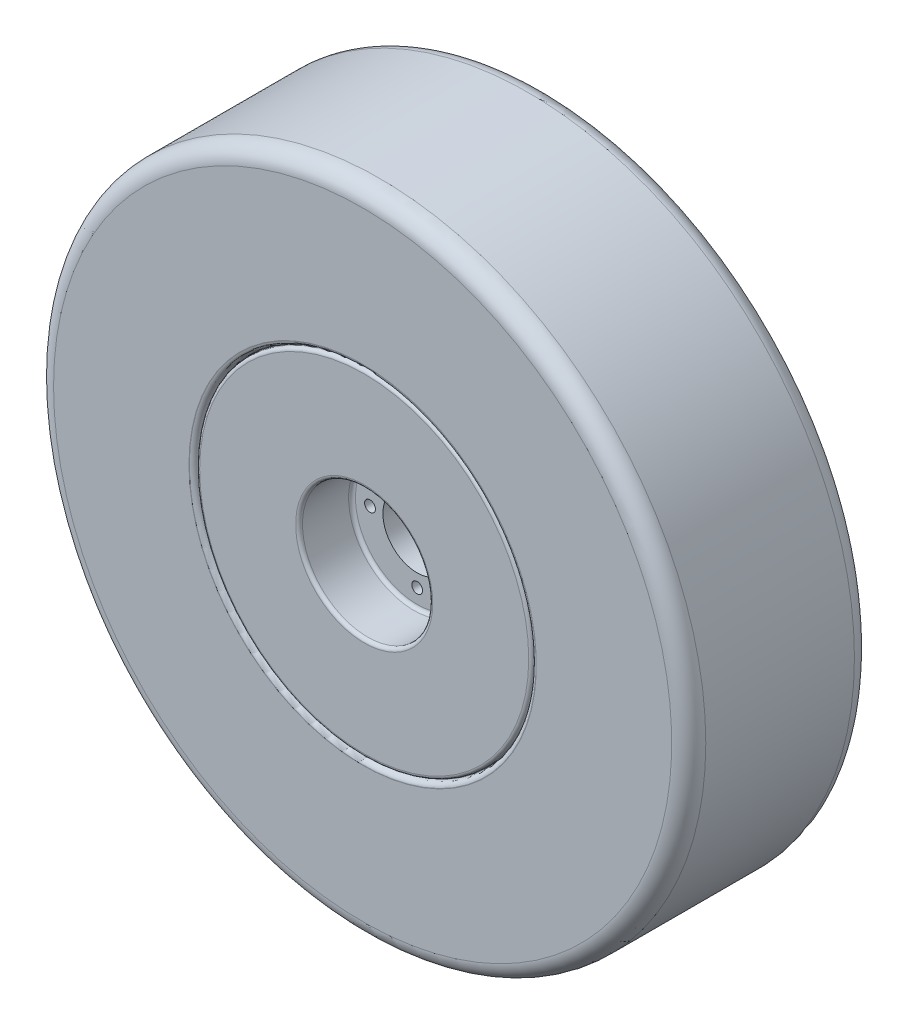
from build123d import *

# Parameters (mm, degrees)
CROQUIS2_R            = 4.0005
CORTAR_EXTRUIR1_DEPTH = 200.591359279


with BuildPart() as part:
    # Croquis1 → Revolución1 (revolve)
    with BuildSketch(Plane(origin=(0, 0, 0), x_dir=(0, 0, -1), z_dir=(1, 0, 0)), mode=Mode.PRIVATE) as revoluci_n1_sk:
        with BuildLine():
            Line((-2.032, 25.4), (52.832, 25.4))
            Line((52.832, 25.4), (52.832, 45.72))
            ThreePointArc((52.832, 45.72), (53.575948776, 47.516051224), (55.372, 48.26))
            Line((55.372, 48.26), (89.535, 48.26))
            ThreePointArc((89.535, 48.26), (91.331051224, 49.003948776), (92.075, 50.8))
            Line((92.075, 50.8), (92.075, 121.92))
            ThreePointArc((92.075, 121.92), (91.331051224, 123.716051224), (89.535, 124.46))
            Line((89.535, 124.46), (81.915, 124.46))
            ThreePointArc((81.915, 124.46), (80.118948776, 123.716051224), (79.375, 121.92))
            Line((79.375, 121.92), (79.375, 63.5))
            ThreePointArc((79.375, 63.5), (78.631051224, 61.703948776), (76.835, 60.96))
            Line((76.835, 60.96), (-26.035, 60.96))
            ThreePointArc((-26.035, 60.96), (-27.831051224, 61.703948776), (-28.575, 63.5))
            Line((-28.575, 63.5), (-28.575, 121.92))
            ThreePointArc((-28.575, 121.92), (-29.318948776, 123.716051224), (-31.115, 124.46))
            Line((-31.115, 124.46), (-38.735, 124.46))
            ThreePointArc((-38.735, 124.46), (-40.531051224, 123.716051224), (-41.275, 121.92))
            Line((-41.275, 121.92), (-41.275, 50.8))
            ThreePointArc((-41.275, 50.8), (-40.531051224, 49.003948776), (-38.735, 48.26))
            Line((-38.735, 48.26), (-4.572, 48.26))
            ThreePointArc((-4.572, 48.26), (-2.775948776, 47.516051224), (-2.032, 45.72))
            Line((-2.032, 45.72), (-2.032, 25.4))
        make_face()
    revolve(revoluci_n1_sk.sketch.rotate(Axis((0, 0, 41.275), (0, 0, -1)), 90), axis=Axis((0, 0, 41.275), (0, 0, -1)))

    # Croquis2 → Cortar-Extruir1 (cut, through all)
    with BuildSketch(Plane.XY.offset(2.032)):
        with Locations((0, 34.925)):
            Circle(CROQUIS2_R)
        with Locations((34.925, 0)):
            Circle(CROQUIS2_R)
        with Locations((0, -34.925)):
            Circle(CROQUIS2_R)
        with Locations((-34.925, 0)):
            Circle(CROQUIS2_R)
    extrude(amount=-CORTAR_EXTRUIR1_DEPTH, mode=Mode.SUBTRACT)

    # Croquis3 → Revolución2 (revolve)
    with BuildSketch(Plane(origin=(0, 0, 0), x_dir=(0, 0, -1), z_dir=(1, 0, 0)), mode=Mode.PRIVATE) as revoluci_n2_sk:
        with BuildLine():
            Line((-38.394703691, 124.854022526), (-30.774703691, 124.854022526))
            ThreePointArc((-30.774703691, 124.854022526), (-28.978652467, 124.110073751), (-28.234703691, 122.314022526))
            Line((-28.234703691, 122.314022526), (-28.234703691, 114.694022526))
            ThreePointArc((-28.234703691, 114.694022526), (-27.490754915, 112.897971302), (-25.694703691, 112.154022526))
            Line((-25.694703691, 112.154022526), (-25.394703691, 112.154022526))
            ThreePointArc((-25.394703691, 112.154022526), (-22.369011136, 112.518599855), (-20.234703691, 114.694022526))
            Line((-20.234703691, 114.694022526), (-20.234703691, 127.04885032))
            ThreePointArc((-20.234703691, 127.04885032), (-21.934999264, 131.153726953), (-26.039875897, 132.854022526))
            Line((-26.039875897, 132.854022526), (-29.421118206, 132.854022526))
            ThreePointArc((-29.421118206, 132.854022526), (-32.956652112, 134.31848862), (-34.421118206, 137.854022526))
            Line((-34.421118206, 137.854022526), (-34.421118206, 157.580586357))
            Line((-34.421118206, 157.580586357), (-34.421118206, 221.416885885))
            ThreePointArc((-34.421118206, 221.416885885), (-32.212703336, 226.748471015), (-26.881118206, 228.956885885))
            Line((-26.881118206, 228.956885885), (77.417803854, 228.956885885))
            ThreePointArc((77.417803854, 228.956885885), (82.749388984, 226.748471015), (84.957803854, 221.416885885))
            Line((84.957803854, 221.416885885), (84.957803854, 219.773449716))
            Line((84.957803854, 219.773449716), (84.957803854, 137.489276356))
            ThreePointArc((84.957803854, 137.489276356), (83.469906303, 133.897173908), (79.877803854, 132.409276356))
            Line((79.877803854, 132.409276356), (77.166396892, 132.409276356))
            ThreePointArc((77.166396892, 132.409276356), (73.061520259, 130.708980783), (71.361224685, 126.60410415))
            Line((71.361224685, 126.60410415), (71.361224685, 114.249276356))
            ThreePointArc((71.361224685, 114.249276356), (72.754385165, 112.482071539), (74.867841243, 111.709276356))
            Line((74.867841243, 111.709276356), (76.821224685, 111.709276356))
            ThreePointArc((76.821224685, 111.709276356), (78.617275909, 112.453225132), (79.361224685, 114.249276356))
            Line((79.361224685, 114.249276356), (79.361224685, 121.869276356))
            ThreePointArc((79.361224685, 121.869276356), (80.105173461, 123.66532758), (81.901224685, 124.409276356))
            Line((81.901224685, 124.409276356), (89.521224685, 124.409276356))
            ThreePointArc((89.521224685, 124.409276356), (91.398383227, 126.053851556), (92.957803854, 128.002327649))
            Line((92.957803854, 128.002327649), (92.957803854, 192.126885885))
            Line((92.957803854, 192.126885885), (92.957803854, 229.036885885))
            ThreePointArc((92.957803854, 229.036885885), (89.261491433, 237.960573463), (80.337803854, 241.656885885))
            Line((80.337803854, 241.656885885), (-29.801118206, 241.656885885))
            ThreePointArc((-29.801118206, 241.656885885), (-38.724805785, 237.960573463), (-42.421118206, 229.036885885))
            Line((-42.421118206, 229.036885885), (-42.421118206, 132.152791569))
            Line((-42.421118206, 132.152791569), (-42.421118206, 128.729707675))
            ThreePointArc((-42.421118206, 128.729707675), (-42.418238783, 128.608797874), (-42.409607041, 128.488162207))
            ThreePointArc((-42.409607041, 128.488162207), (-41.106820913, 125.892596129), (-38.394703691, 124.854022526))
        make_face()
        with BuildLine():
            Line((-29.801118206, 241.656885885), (80.337803854, 241.656885885))
            ThreePointArc((80.337803854, 241.656885885), (89.261491433, 237.960573463), (92.957803854, 229.036885885))
            Line((92.957803854, 229.036885885), (92.957803854, 192.126885885))
            Line((92.957803854, 192.126885885), (92.957803854, 128.002327649))
            ThreePointArc((92.957803854, 128.002327649), (91.398383227, 126.053851556), (89.521224685, 124.409276356))
            Line((89.521224685, 124.409276356), (81.901224685, 124.409276356))
            ThreePointArc((81.901224685, 124.409276356), (80.105173461, 123.66532758), (79.361224685, 121.869276356))
            Line((79.361224685, 121.869276356), (79.361224685, 114.249276356))
            ThreePointArc((79.361224685, 114.249276356), (78.617275909, 112.453225132), (76.821224685, 111.709276356))
            Line((76.821224685, 111.709276356), (74.867841243, 111.709276356))
            ThreePointArc((74.867841243, 111.709276356), (72.754385165, 112.482071539), (71.361224685, 114.249276356))
            Line((71.361224685, 114.249276356), (71.361224685, 126.60410415))
            ThreePointArc((71.361224685, 126.60410415), (73.061520259, 130.708980783), (77.166396892, 132.409276356))
            Line((77.166396892, 132.409276356), (79.877803854, 132.409276356))
            ThreePointArc((79.877803854, 132.409276356), (83.469906303, 133.897173908), (84.957803854, 137.489276356))
            Line((84.957803854, 137.489276356), (84.957803854, 219.773449716))
            Line((84.957803854, 219.773449716), (84.957803854, 221.416885885))
            ThreePointArc((84.957803854, 221.416885885), (82.749388984, 226.748471015), (77.417803854, 228.956885885))
            Line((77.417803854, 228.956885885), (-26.881118206, 228.956885885))
            ThreePointArc((-26.881118206, 228.956885885), (-32.212703336, 226.748471015), (-34.421118206, 221.416885885))
            Line((-34.421118206, 221.416885885), (-34.421118206, 157.580586357))
            Line((-34.421118206, 157.580586357), (-34.421118206, 137.854022526))
            ThreePointArc((-34.421118206, 137.854022526), (-32.956652112, 134.31848862), (-29.421118206, 132.854022526))
            Line((-29.421118206, 132.854022526), (-26.039875897, 132.854022526))
            ThreePointArc((-26.039875897, 132.854022526), (-21.934999264, 131.153726953), (-20.234703691, 127.04885032))
            Line((-20.234703691, 127.04885032), (-20.234703691, 114.694022526))
            ThreePointArc((-20.234703691, 114.694022526), (-22.369011136, 112.518599855), (-25.394703691, 112.154022526))
            Line((-25.394703691, 112.154022526), (-25.694703691, 112.154022526))
            ThreePointArc((-25.694703691, 112.154022526), (-27.490754915, 112.897971302), (-28.234703691, 114.694022526))
            Line((-28.234703691, 114.694022526), (-28.234703691, 122.314022526))
            ThreePointArc((-28.234703691, 122.314022526), (-28.978652467, 124.110073751), (-30.774703691, 124.854022526))
            Line((-30.774703691, 124.854022526), (-38.394703691, 124.854022526))
            ThreePointArc((-38.394703691, 124.854022526), (-41.106820913, 125.892596129), (-42.409607041, 128.488162207))
            ThreePointArc((-42.409607041, 128.488162207), (-42.418238783, 128.608797874), (-42.421118206, 128.729707675))
            Line((-42.421118206, 128.729707675), (-42.421118206, 132.152791569))
            Line((-42.421118206, 132.152791569), (-42.421118206, 229.036885885))
            ThreePointArc((-42.421118206, 229.036885885), (-38.724805785, 237.960573463), (-29.801118206, 241.656885885))
        make_face()
    revolve(revoluci_n2_sk.sketch.rotate(Axis((0, 0, -183.047172604), (0, 0, 1)), 90), axis=Axis((0, 0, -183.047172604), (0, 0, 1)))


solid = part.part
